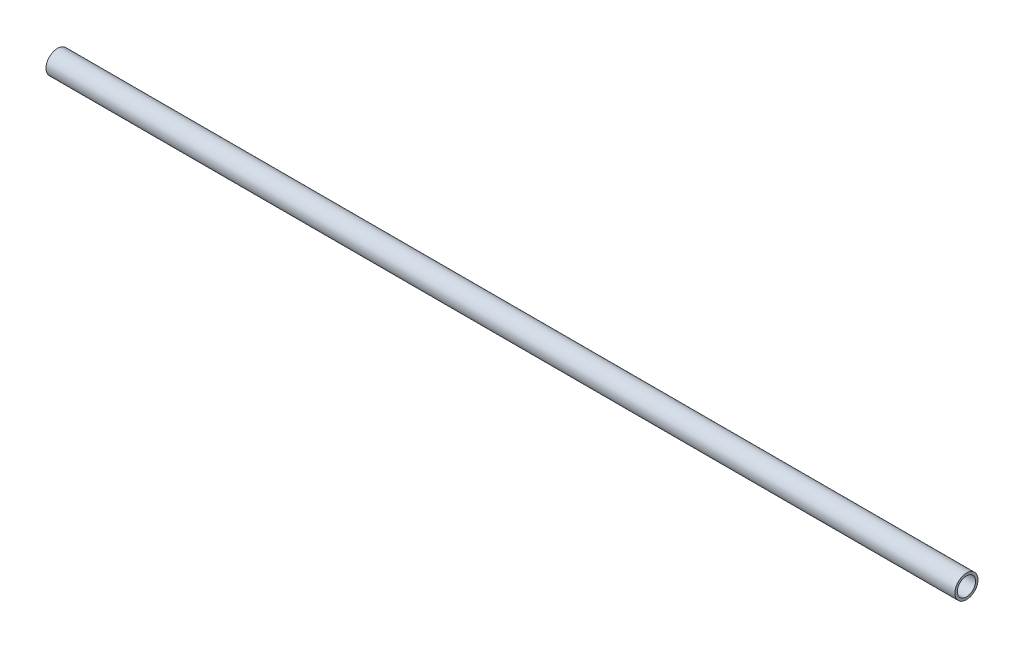
from build123d import *

# Parameters (mm, degrees)
SKETCH1_R           = 6.35
SKETCH1_R_2         = 5
BOSS_EXTRUDE1_DEPTH = 500


with BuildPart() as part:
    # Sketch1 → Boss-Extrude1 (new body)
    with BuildSketch(Plane.YZ):
        with Locations(Location((0, 0, 0), (0, 0, 270))):
            Circle(SKETCH1_R)
        with Locations(Location((0, 0, 0), (0, 0, 270))):
            Circle(SKETCH1_R_2, mode=Mode.SUBTRACT)
    extrude(amount=BOSS_EXTRUDE1_DEPTH)


solid = part.part
